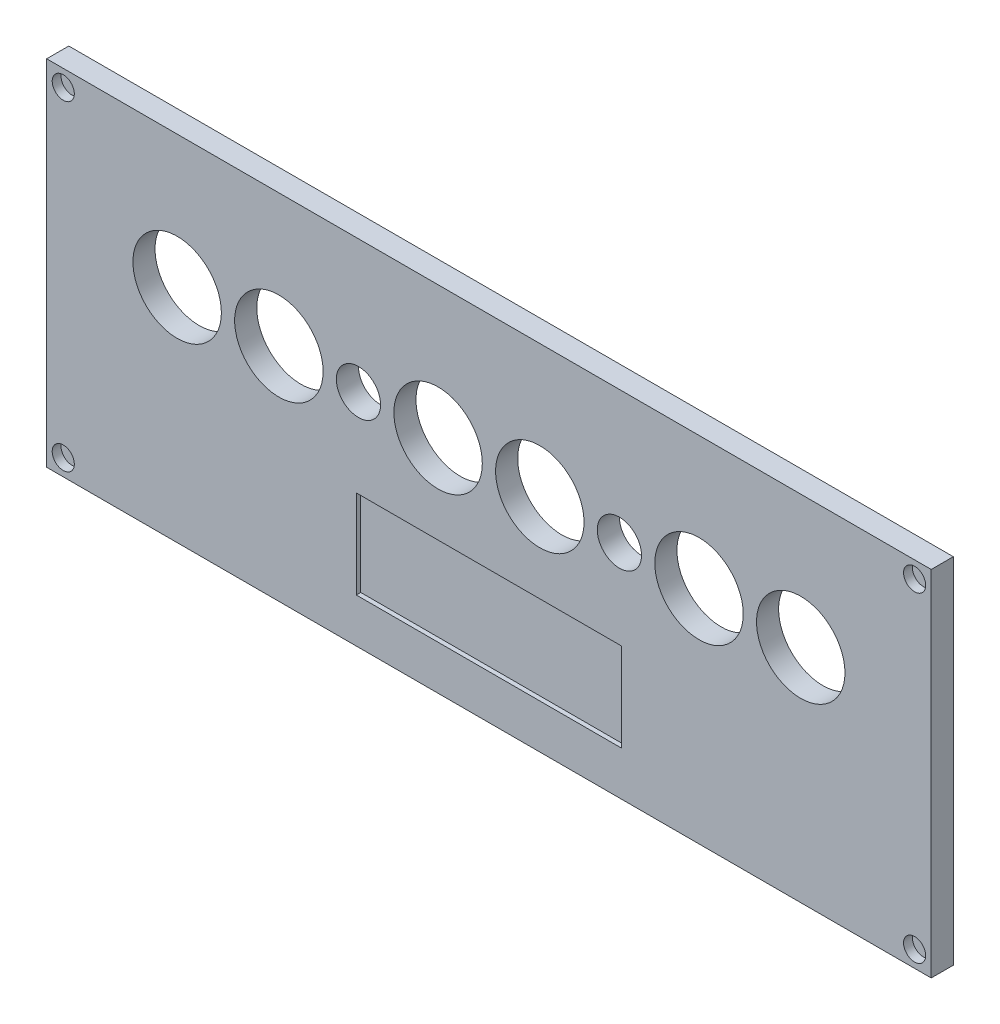
from build123d import *

# Parameters (mm, degrees)
CROQUIS1_W              = 200
CROQUIS1_H              = 80
SALIENTE_EXTRUIR1_DEPTH = 5
CROQUIS2_R              = 2.5
CORTAR_EXTRUIR1_DEPTH   = 2
CROQUIS3_W              = 60
CROQUIS3_H              = 20
CORTAR_EXTRUIR2_DEPTH   = 1
CROQUIS4_R              = 10
CROQUIS4_R_2            = 5
CORTAR_EXTRUIR3_DEPTH   = 5


with BuildPart() as part:
    # Croquis1 → Saliente-Extruir1 (new body)
    with BuildSketch(Plane.XY):
        Rectangle(CROQUIS1_W, CROQUIS1_H)
    extrude(amount=SALIENTE_EXTRUIR1_DEPTH)

    # Croquis2 → Cortar-Extruir1 (cut)
    with BuildSketch(Plane.XY.offset(5)):
        with Locations((-96.25, 36.25)):
            Circle(CROQUIS2_R)
        with Locations((96.25, 36.25)):
            Circle(CROQUIS2_R)
        with Locations((96.25, -36.25)):
            Circle(CROQUIS2_R)
        with Locations((-96.25, -36.25)):
            Circle(CROQUIS2_R)
    extrude(amount=-CORTAR_EXTRUIR1_DEPTH, mode=Mode.SUBTRACT)

    # Croquis3 → Cortar-Extruir2 (cut)
    with BuildSketch(Plane.XY.offset(5)):
        with Locations((0, -20)):
            Rectangle(CROQUIS3_W, CROQUIS3_H)
    extrude(amount=-CORTAR_EXTRUIR2_DEPTH, mode=Mode.SUBTRACT)

    # Croquis4 → Cortar-Extruir3 (cut)
    with BuildSketch(Plane.XY.offset(5)):
        with Locations((-70.5, 10)):
            Circle(CROQUIS4_R)
        with Locations((-47.5, 10)):
            Circle(CROQUIS4_R)
        with Locations((-29.5, 10)):
            Circle(CROQUIS4_R_2)
        with Locations((-11.5, 10)):
            Circle(CROQUIS4_R)
        with Locations((11.5, 10)):
            Circle(CROQUIS4_R)
        with Locations((29.5, 10)):
            Circle(CROQUIS4_R_2)
        with Locations((47.5, 10)):
            Circle(CROQUIS4_R)
        with Locations((70.5, 10)):
            Circle(CROQUIS4_R)
    extrude(amount=-CORTAR_EXTRUIR3_DEPTH, mode=Mode.SUBTRACT)


solid = part.part
